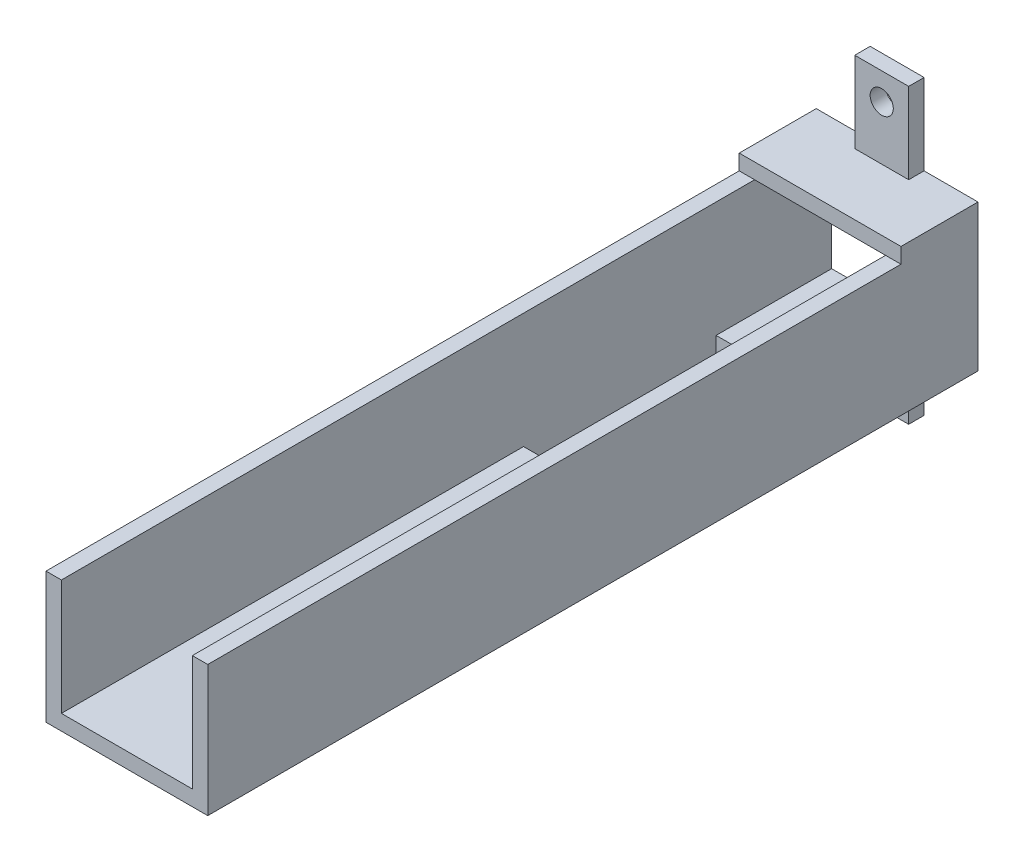
from build123d import *

# Parameters (mm, degrees)
EXTRUDE_1_DEPTH     = 100
CUT_EXTRUDE_1_DEPTH = 102.662431606
SKETCH_3_W          = 21
SKETCH_3_H          = 2
EXTRUDE_2_DEPTH     = 10
SKETCH_4_R          = 1.5
EXTRUDE_3_DEPTH     = 2


with BuildPart() as part:
    # Эскиз1 → Бобышка-Вытянуть1 (new body)
    with BuildSketch(Plane.XY):
        Polygon((0, 0), (-8.5, 0), (-8.5, 15), (-10.5, 15), (-10.5, -2), (10.5, -2), (10.5, 15), (8.5, 15), (8.5, 0), align=None)
    extrude(amount=EXTRUDE_1_DEPTH)

    # Эскиз2 → Вырез-Вытянуть1 (cut, through all)
    with BuildSketch(Plane(origin=(0, 0, 0), x_dir=(1, 0, 0), z_dir=(0, 1, 0))):
        Polygon((0, -15), (-8.5, -15), (-8.5, -40), (8.5, -40), (8.5, -15), align=None)
    extrude(amount=-CUT_EXTRUDE_1_DEPTH, mode=Mode.SUBTRACT)

    # Эскиз3 → Бобышка-Вытянуть2 (add)
    with BuildSketch(Plane(origin=(0, 0, 0), x_dir=(-1, 0, 0), z_dir=(0, 0, -1))):
        with Locations((0, 16)):
            Rectangle(SKETCH_3_W, SKETCH_3_H)
    extrude(amount=-EXTRUDE_2_DEPTH)

    # Эскиз4 → Бобышка-Вытянуть3 (add)
    # profile 1 of 2: a face of its own
    with BuildSketch(Plane(origin=(0, 0, 0), x_dir=(-1, 0, 0), z_dir=(0, 0, -1))):
        Polygon((-3.5, 27.5), (3.5, 27.5), (3.5, 20.5), (3.5, 17), (0, 17), (-3.5, 17), (-3.5, 20.5), align=None)
        with Locations((0, 24)):
            Circle(SKETCH_4_R, mode=Mode.SUBTRACT)
    # profile 2 of 2: a face of its own
    with BuildSketch(Plane(origin=(0, 0, 0), x_dir=(-1, 0, 0), z_dir=(0, 0, -1))):
        Polygon((3.5, -3.5), (3.5, -10.5), (-3.5, -10.5), (-3.5, -3.5), (-3.5, -2), (0, -2), (3.5, -2), align=None)
        with Locations((0, -7)):
            Circle(SKETCH_4_R, mode=Mode.SUBTRACT)
    extrude(amount=-EXTRUDE_3_DEPTH)


solid = part.part
